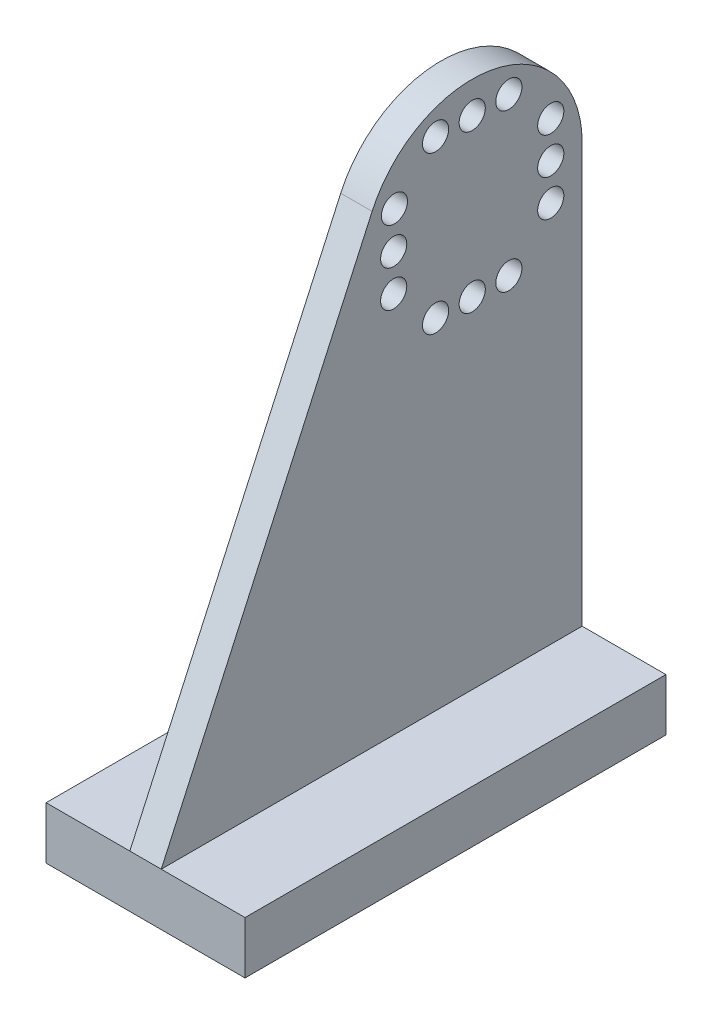
from build123d import *

# Parameters (mm, degrees)
SKETCH1_R           = 1.25
BOSS_EXTRUDE1_DEPTH = 3
SKETCH2_W           = 3
SKETCH2_H           = 40.2
BOSS_EXTRUDE2_DEPTH = 5
SKETCH4_W           = 40.2
SKETCH4_H           = 5
BOSS_EXTRUDE3_DEPTH = 8
SKETCH7_W           = 40.2
SKETCH7_H           = 5
BOSS_EXTRUDE4_DEPTH = 8
SKETCH9_R           = 1.25
CUT_EXTRUDE1_DEPTH  = 8


with BuildPart() as part:
    # Sketch1 → Boss-Extrude1 (new body)
    # profile 1 of 2: a face of its own
    with BuildSketch(Plane(origin=(0, 0, 0), x_dir=(0, 0, -1), z_dir=(1, 0, 0))):
        with BuildLine():
            Line((10.5, -40), (10.5, 0))
            ThreePointArc((10.5, 0), (-2.221347256, -10.262339712), (-9.560117404, 4.342137172))
            Line((-9.560117404, 4.342137172), (-29.7, -40))
            Line((-29.7, -40), (10.5, -40))
        make_face()
    # profile 2 of 2: a face of its own
    with BuildSketch(Plane(origin=(0, 0, 0), x_dir=(0, 0, -1), z_dir=(1, 0, 0))):
        with BuildLine():
            ThreePointArc((-9.560117404, 4.342137172), (-2.221347256, -10.262339712), (10.5, 0))
            ThreePointArc((10.5, 0), (2.221347256, 10.262339712), (-9.560117404, 4.342137172))
        make_face()
        with Locations((-7.5, -3.5)):
            Circle(SKETCH1_R, mode=Mode.SUBTRACT)
        with Locations((-3.5, -7.5)):
            Circle(SKETCH1_R, mode=Mode.SUBTRACT)
        with Locations((0, -7.5)):
            Circle(SKETCH1_R, mode=Mode.SUBTRACT)
        with Locations((3.5, -7.5)):
            Circle(SKETCH1_R, mode=Mode.SUBTRACT)
        with Locations((7.5, -3.5)):
            Circle(SKETCH1_R, mode=Mode.SUBTRACT)
        with Locations((-7.5, 0)):
            Circle(SKETCH1_R, mode=Mode.SUBTRACT)
        with Locations((-7.428270452, 3.499264905)):
            Circle(SKETCH1_R, mode=Mode.SUBTRACT)
        with Locations((-3.5, 7.5)):
            Circle(SKETCH1_R, mode=Mode.SUBTRACT)
        with Locations((0, 7.5)):
            Circle(SKETCH1_R, mode=Mode.SUBTRACT)
        with Locations((7.5, 0)):
            Circle(SKETCH1_R, mode=Mode.SUBTRACT)
        with Locations((7.5, 3.5)):
            Circle(SKETCH1_R, mode=Mode.SUBTRACT)
        with Locations((3.5, 7.5)):
            Circle(SKETCH1_R, mode=Mode.SUBTRACT)
    extrude(amount=BOSS_EXTRUDE1_DEPTH)

    # Sketch2 → Boss-Extrude2 (add)
    with BuildSketch(Plane(origin=(0, -40, 0), x_dir=(-1, 0, 0), z_dir=(0, -1, 0))):
        with Locations((-1.5, -9.6)):
            Rectangle(SKETCH2_W, SKETCH2_H)
    extrude(amount=BOSS_EXTRUDE2_DEPTH)

    # Sketch4 → Boss-Extrude3 (add)
    with BuildSketch(Plane.ZY):
        with Locations((9.6, -42.5)):
            Rectangle(SKETCH4_W, SKETCH4_H)
    extrude(amount=BOSS_EXTRUDE3_DEPTH)


with BuildPart() as body_2:
    # Mirror1: mirrored copy
    add(part.part.mirror(Plane(origin=(3, 0, 0), x_dir=(0, 0, 1), z_dir=(1, 0, 0))))

    # Sketch7 → Boss-Extrude4 (add)
    with BuildSketch(Plane.ZY.offset(-3)):
        with Locations((9.6, -42.5)):
            Rectangle(SKETCH7_W, SKETCH7_H)
    extrude(amount=BOSS_EXTRUDE4_DEPTH)

    # Sketch9 → Cut-Extrude1 (cut)
    with BuildSketch(Plane(origin=(0, -40, 0), x_dir=(1, 0, 0), z_dir=(0, 1, 0))):
        with Locations(Location((-1, 0.5, 0), (0, 0, 270))):
            Circle(SKETCH9_R)
        with Locations(Location((-1, -19.7, 0), (0, 0, 270))):
            Circle(SKETCH9_R)
    extrude(amount=-CUT_EXTRUDE1_DEPTH, mode=Mode.SUBTRACT)


solid = body_2.part
